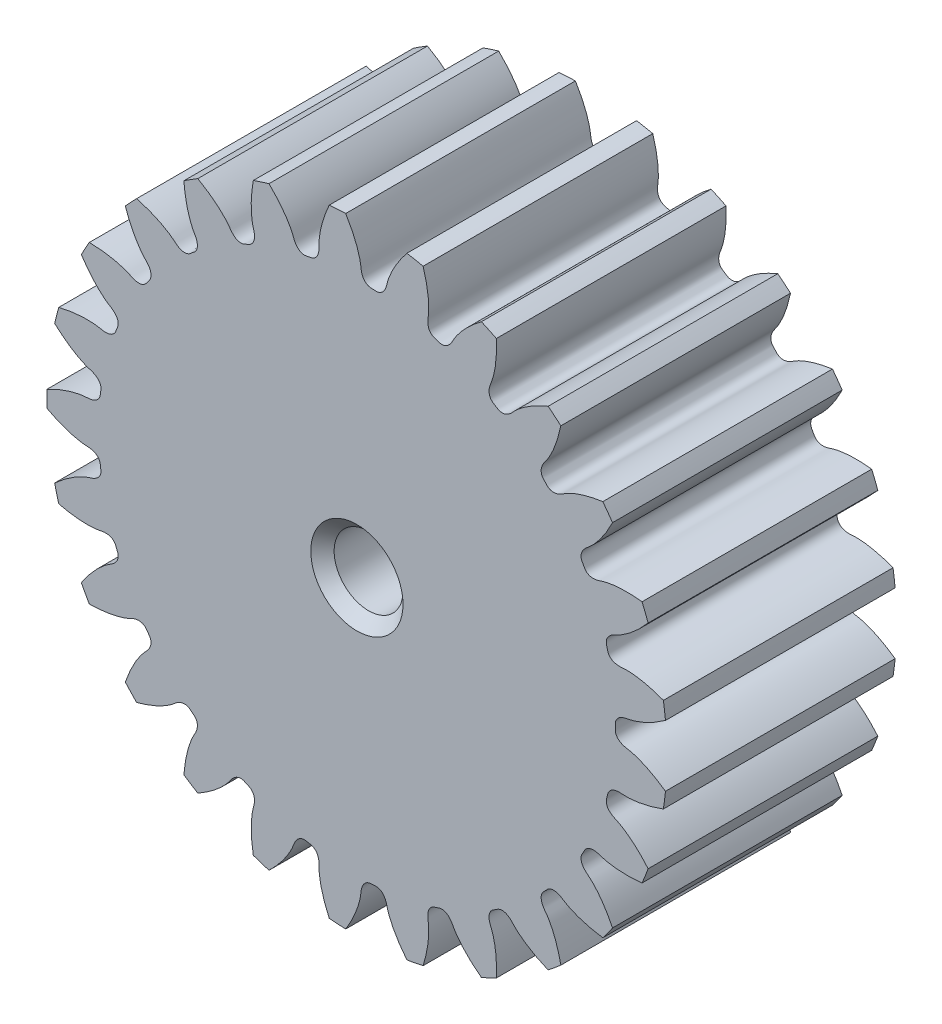
from build123d import *

# Parameters (mm, degrees)
SKETCHREVOLVEPLANET_REVOLVING_FOLLOWER01_W     = 5
SKETCHREVOLVEPLANET_REVOLVING_FOLLOWER01_H     = 6.749999899
TOOTHEXTRUDECUTPLANET_REVOLVING_FOLLOWER_DEPTH = 2.5
PATTERNPLANET_REVOLVING_FOLLOWER01_COUNT       = 25


with BuildPart() as part:
    # SketchRevolvePlanet_Revolving_Follower01 → Planet_Revolving_Follower01 (revolve)
    with BuildSketch(Plane(origin=(0, 0, 0), x_dir=(0, 0, -1), z_dir=(1, 0, 0))):
        with Locations((0, 3.37499995)):
            Rectangle(SKETCHREVOLVEPLANET_REVOLVING_FOLLOWER01_W, SKETCHREVOLVEPLANET_REVOLVING_FOLLOWER01_H)
    revolve(axis=Axis((0, 0, 0), (0, 0, -1)))

    # SketchToothPlanet_Revolving_Follower01 → ToothExtrudeCutPlanet_Revolving_Follower01 (cut, symmetric)
    with BuildSketch(Plane.XY):
        with BuildLine():
            ThreePointArc((6.74039554, 0.683879802), (6.774999898, 0), (6.74039554, -0.683879802))
            add(Edge.make_bspline(
                [(6.74039554, -0.683879802), (6.690443417, -0.647993937), (6.616055967, -0.597558879), (6.516785383, -0.536485341), (6.447358891, -0.496475312), (6.381087446, -0.460778811), (6.318158142, -0.429179522), (6.258748195, -0.40145393), (6.20302467, -0.377371891), (6.151144289, -0.356696809), (6.103253088, -0.339186689), (6.0594866, -0.32459247), (6.01996841, -0.312665121), (5.98481394, -0.303135038), (5.954118068, -0.295777385), (5.912141223, -0.286844722), (5.875234971, -0.281923397), (5.84310445, -0.274498064), (5.829427213, -0.270987101), (5.816045165, -0.267147483), (5.802938665, -0.262970066), (5.790087641, -0.258428271), (5.777469635, -0.253491534), (5.765060683, -0.248119733), (5.752835878, -0.242262154), (5.740770715, -0.235854785), (5.728843273, -0.228817579), (5.717037793, -0.22105143), (5.705350207, -0.212435363), (5.69379637, -0.202824717), (5.682423714, -0.192051802), (5.671326629, -0.179931425), (5.66066467, -0.166274744), (5.650680388, -0.150915255), (5.641709037, -0.133749929), (5.634171594, -0.114791303), (5.628529064, -0.094225922), (5.625441402, -0.073791473), (5.624116128, -0.042242554), (5.625659683, 0), (5.624116128, 0.042242554), (5.625441402, 0.073791473), (5.628529064, 0.094225922), (5.634171594, 0.114791303), (5.641709037, 0.133749929), (5.650680388, 0.150915255), (5.66066467, 0.166274744), (5.671326629, 0.179931425), (5.682423714, 0.192051802), (5.69379637, 0.202824717), (5.705350207, 0.212435363), (5.717037793, 0.22105143), (5.728843273, 0.228817579), (5.740770715, 0.235854785), (5.752835878, 0.242262154), (5.765060683, 0.248119733), (5.777469635, 0.253491534), (5.790087641, 0.258428271), (5.802938665, 0.262970066), (5.816045165, 0.267147483), (5.829427213, 0.270987101), (5.84310445, 0.274498064), (5.875234971, 0.281923397), (5.912141223, 0.286844722), (5.954118068, 0.295777385), (5.98481394, 0.303135038), (6.01996841, 0.312665121), (6.0594866, 0.32459247), (6.103253088, 0.339186689), (6.151144289, 0.356696809), (6.20302467, 0.377371891), (6.258748195, 0.40145393), (6.318158142, 0.429179522), (6.381087446, 0.460778811), (6.447358891, 0.496475312), (6.516785383, 0.536485341), (6.616055967, 0.597558879), (6.690443417, 0.647993937), (6.74039554, 0.683879802)],
                knots=[0, 0, 0, 0, 0.066592486, 0.097260078, 0.126175237, 0.153337961, 0.178748252, 0.202406109, 0.224311533, 0.244464522, 0.262865078, 0.2795132, 0.294408888, 0.307552142, 0.318942963, 0.32858135, 0.354009635, 0.359185096, 0.364277395, 0.369297063, 0.374256261, 0.37916906, 0.38405178, 0.388923371, 0.393805851, 0.398724764, 0.403709653, 0.408794462, 0.414017764, 0.419422613, 0.425055715, 0.430965484, 0.437198416, 0.443793278, 0.450772917, 0.458134465, 0.465840213, 0.473812957, 0.480450771, 0.5, 0.519549229, 0.526187043, 0.534159787, 0.541865535, 0.549227083, 0.556206722, 0.562801584, 0.569034516, 0.574944285, 0.580577387, 0.585982236, 0.591205538, 0.596290347, 0.601275236, 0.606194149, 0.611076629, 0.61594822, 0.62083094, 0.625743739, 0.630702937, 0.635722605, 0.640814904, 0.645990365, 0.67141865, 0.681057037, 0.692447858, 0.705591112, 0.7204868, 0.737134922, 0.755535478, 0.775688467, 0.797593891, 0.821251748, 0.846662039, 0.873824763, 0.902739922, 0.933407514, 1, 1, 1, 1], degree=3))
        make_face()
    toothextrudecutplanet_revolving_follower = extrude(amount=TOOTHEXTRUDECUTPLANET_REVOLVING_FOLLOWER_DEPTH, both=True, mode=Mode.SUBTRACT)

    # PatternPlanet_Revolving_Follower01: ToothExtrudeCutPlanet_Revolving_Follower01 ×25 about axis
    patternplanet_revolving_follower01_axis = Axis((0, 0, 50), (0, 0, -1))
    for i in range(1, PATTERNPLANET_REVOLVING_FOLLOWER01_COUNT):
        add(toothextrudecutplanet_revolving_follower.rotate(patternplanet_revolving_follower01_axis, i * 360 / PATTERNPLANET_REVOLVING_FOLLOWER01_COUNT), mode=Mode.SUBTRACT)

    # BoreRevolveSketch → BoreRevolveCut (revolve, cut)
    with BuildSketch(Plane(origin=(0, 0, 0), x_dir=(0, 0, -1), z_dir=(1, 0, 0))):
        Polygon((-2.5, 0), (2.5, 0), (2.5, 1.003999996), (2.246000004, 0.75), (-2.246000004, 0.75), (-2.5, 1.003999996), align=None)
    revolve(axis=Axis((0, 0, 0), (0, 0, -1)), mode=Mode.SUBTRACT)


solid = part.part
